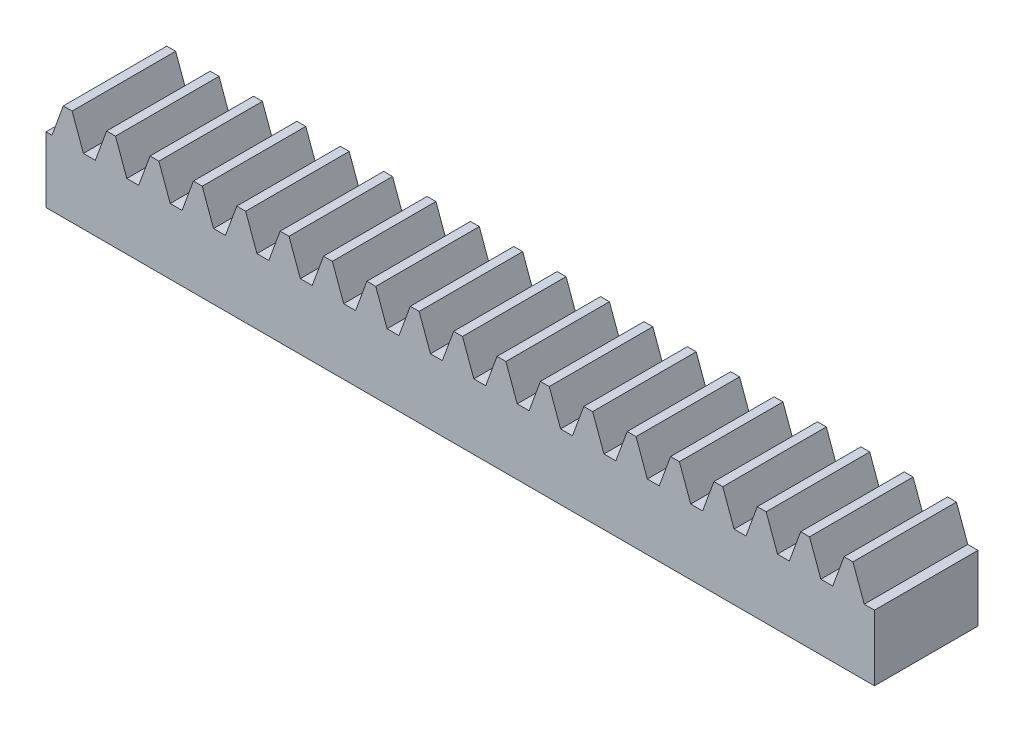
from build123d import *

# Parameters (mm, degrees)
BLANKSKE_W        = 120
BLANKSKE_H        = 14
BLANK_DEPTH       = 15
TOOTHCUTSIM_DEPTH = 122.741529479
TEETHCUTS_COUNT   = 21
TEETHCUTS_PITCH   = 6.2831853


with BuildPart() as part:
    # BlankSke → Blank (new body)
    with BuildSketch(Plane.XY):
        with Locations((60, 7)):
            Rectangle(BLANKSKE_W, BLANKSKE_H)
    extrude(amount=-BLANK_DEPTH)

    # TooCutSkeSim → ToothCutSim (cut, through all)
    with BuildSketch(Plane.XY):
        Polygon((0.861870739, 9.5), (-0.861870739, 9.5), (-2.508981637, 14.0254), (2.508981637, 14.0254), align=None)
    toothcutsim = extrude(amount=-TOOTHCUTSIM_DEPTH, mode=Mode.SUBTRACT)

    # TeethCuts: ToothCutSim ×21
    with Locations(*[(i * TEETHCUTS_PITCH, 0, 0) for i in range(1, TEETHCUTS_COUNT)]):
        add(toothcutsim, mode=Mode.SUBTRACT)


solid = part.part
